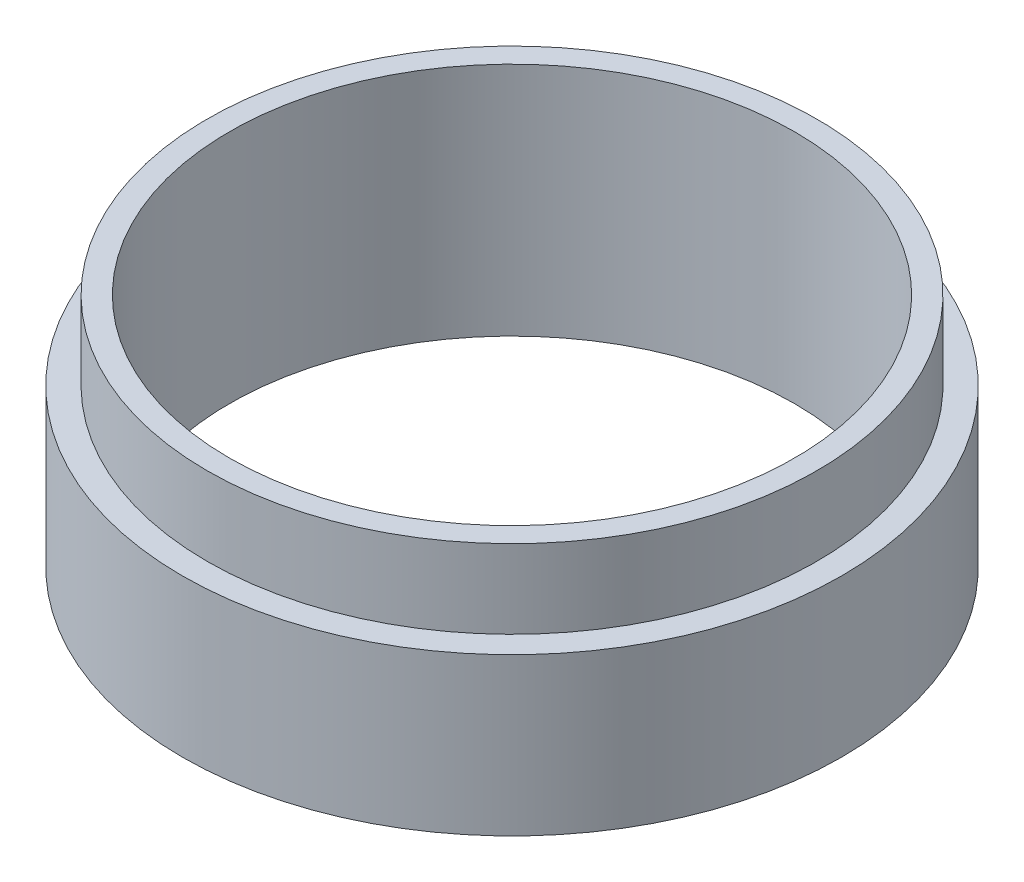
from build123d import *

# Parameters (mm, degrees)
SKETCH1_W           = 21
SKETCH1_H           = 10
SKETCH2_R           = 18
CUT_EXTRUDE1_DEPTH  = 32.336879232
SKETCH4_R           = 19.41
BOSS_EXTRUDE1_DEPTH = 5
SKETCH5_R           = 18
CUT_EXTRUDE2_DEPTH  = 34.271609519


with BuildPart() as part:
    # Sketch1 → Revolve1 (revolve)
    with BuildSketch(Plane.XY, mode=Mode.PRIVATE) as revolve1_sk:
        with Locations((10.5, 5)):
            Rectangle(SKETCH1_W, SKETCH1_H)
    revolve(revolve1_sk.sketch.rotate(Axis((0, 0, 0), (0, 1, 0)), 90), axis=Axis((0, 0, 0), (0, 1, 0)))

    # Sketch2 → Cut-Extrude1 (cut, through all)
    with BuildSketch(Plane(origin=(0, 10, 0), x_dir=(1, 0, 0), z_dir=(0, 1, 0))):
        with Locations(Location((0, 0, 0), (0, 0, 270))):
            Circle(SKETCH2_R)
    extrude(amount=-CUT_EXTRUDE1_DEPTH, mode=Mode.SUBTRACT)

    # Sketch4 → Boss-Extrude1 (add)
    with BuildSketch(Plane(origin=(0, 10, 0), x_dir=(1, 0, 0), z_dir=(0, 1, 0))):
        with Locations(Location((0, 0, 0), (0, 0, 270))):
            Circle(SKETCH4_R)
    extrude(amount=BOSS_EXTRUDE1_DEPTH)

    # Sketch5 → Cut-Extrude2 (cut, through all)
    with BuildSketch(Plane(origin=(0, 15, 0), x_dir=(1, 0, 0), z_dir=(0, 1, 0))):
        with Locations(Location((0, 0, 0), (0, 0, 270))):
            Circle(SKETCH5_R)
    extrude(amount=-CUT_EXTRUDE2_DEPTH, mode=Mode.SUBTRACT)


solid = part.part
